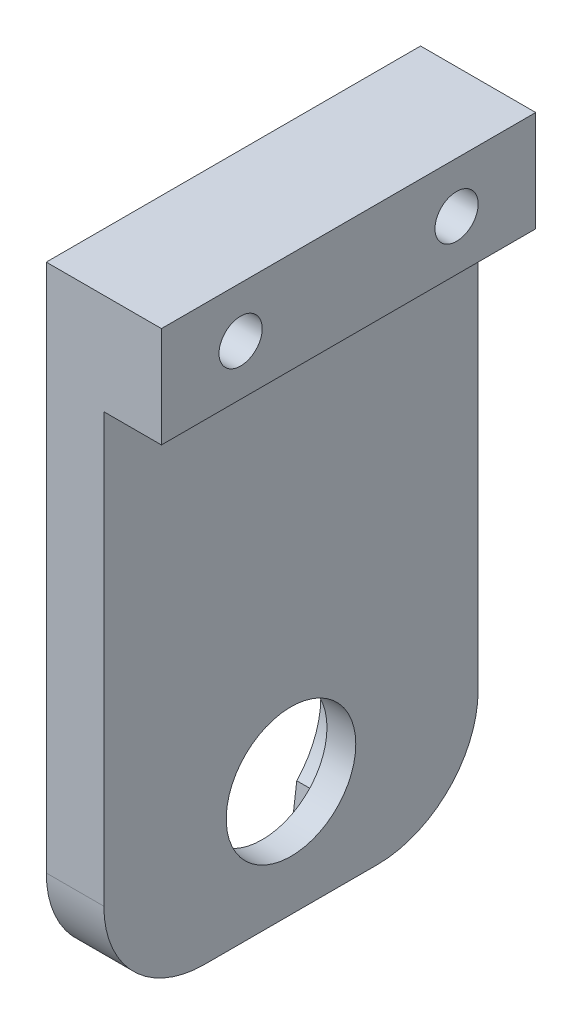
from build123d import *

# Parameters (mm, degrees)
SKETCH_1_W                    = 26
SKETCH_1_H                    = 43.75
EXTRUDE_1_DEPTH               = 8
CUT_EXTRUDE_1_DEPTH           = 2
SKETCH_3_W                    = 4
SKETCH_3_H                    = 36.75
CUT_EXTRUDE_2_DEPTH           = 38.802943007
HOLE_WIZARD_M2_51_D           = 3
HOLE_WIZARD_M2_51_CBORE_D     = 5.5
HOLE_WIZARD_M2_51_CBORE_DEPTH = 1
HOLE_WIZARD_9_0_9_1_D         = 9
HOLE_WIZARD_9_0_9_1_DEPTH     = 4
FILLET_1_R                    = 7


with BuildPart() as part:
    # Эскиз1 → Бобышка-Вытянуть1 (new body)
    with BuildSketch(Plane(origin=(8, 0, 0), x_dir=(0, 0, -1), z_dir=(1, 0, 0))):
        with Locations((0, 4.375)):
            Rectangle(SKETCH_1_W, SKETCH_1_H)
    extrude(amount=-EXTRUDE_1_DEPTH)

    # Эскиз2 → Вырез-Вытянуть1 (cut)
    with BuildSketch(Plane.ZY):
        with BuildLine():
            Line((3.901238196, -17.5), (4.545454545, -13.652408939))
            ThreePointArc((4.545454545, -13.652408939), (6.222727273, -9.431365141), (4.545454545, -5.210321344))
            Line((4.545454545, -5.210321344), (2.795454545, 8.289678656))
            ThreePointArc((2.795454545, 8.289678656), (0.072727273, 11.012405929), (-2.65, 8.289678656))
            Line((-2.65, 8.289678656), (-4.4, -5.210321344))
            ThreePointArc((-4.4, -5.210321344), (-6.077272727, -9.431365141), (-4.4, -13.652408939))
            Line((-4.4, -13.652408939), (-3.901238196, -17.5))
            Line((-3.901238196, -17.5), (3.901238196, -17.5))
        make_face()
    extrude(amount=-CUT_EXTRUDE_1_DEPTH, mode=Mode.SUBTRACT)

    # Эскиз3 → Вырез-Вытянуть2 (cut, through all)
    with BuildSketch(Plane.XY.offset(13)):
        with Locations((6, 0.875)):
            Rectangle(SKETCH_3_W, SKETCH_3_H)
    extrude(amount=-CUT_EXTRUDE_2_DEPTH, mode=Mode.SUBTRACT)

    # Цековка для винта с заклепочной головкой M2.51 (through all)
    with Locations(Plane.ZY):
        with Locations((-7.5, 22.75), (7.5, 22.75)):
            CounterBoreHole(HOLE_WIZARD_M2_51_D / 2, HOLE_WIZARD_M2_51_CBORE_D / 2, HOLE_WIZARD_M2_51_CBORE_DEPTH)

    # Диаметр отверстия Ø9.0 (9)1
    with Locations(Plane(origin=(4, 0, 0), x_dir=(0, 0, -1), z_dir=(1, 0, 0))):
        with Locations((0, -9.5)):
            Hole(HOLE_WIZARD_9_0_9_1_D / 2, depth=HOLE_WIZARD_9_0_9_1_DEPTH)

    # Скругление1
    fillet_1_edges = [part.edges().sort_by_distance(p)[0] for p in [
        (2, -17.5, -13),
        (2, -17.5, 13),
    ]]
    fillet(fillet_1_edges, radius=FILLET_1_R)


solid = part.part
